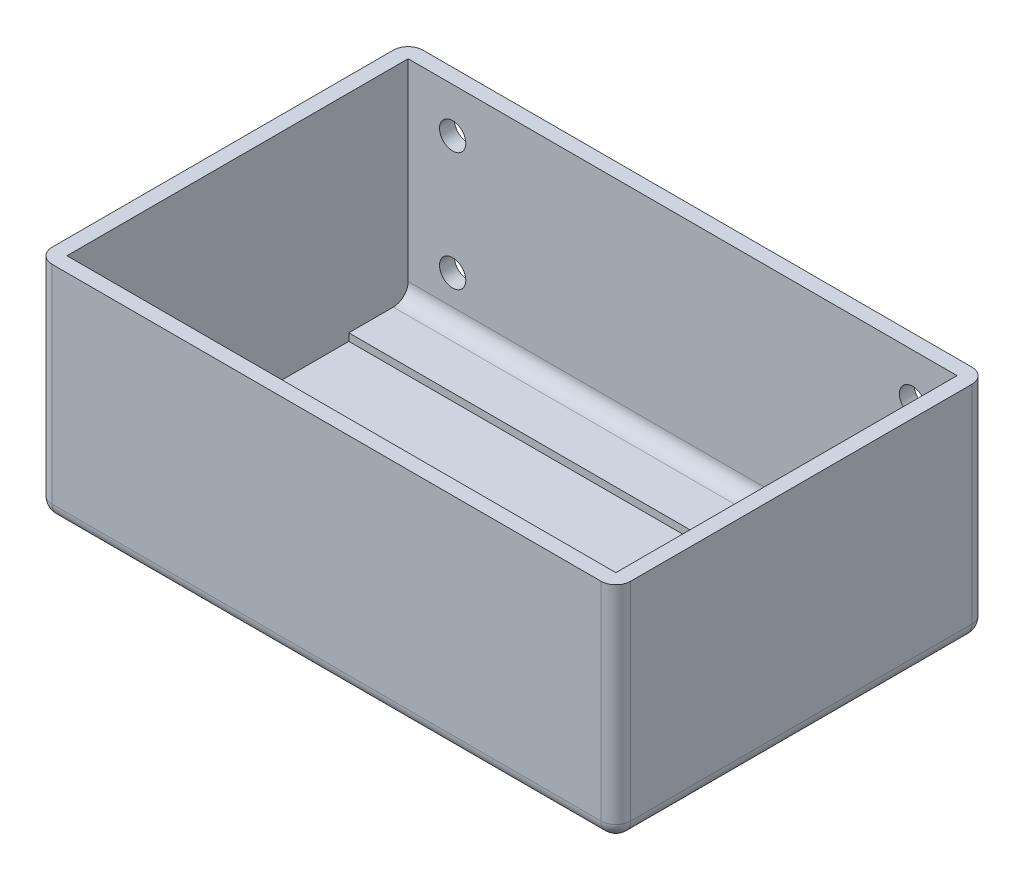
from build123d import *

# Parameters (mm, degrees)
BOSS_EXTRUDE1_DEPTH      = 48.26
FILLET1_R                = 2.5399999999999996
BOSS_EXTRUDE2_START      = -48.26
BOSS_EXTRUDE2_DEPTH      = 2.5399999999999996
BOSS_EXTRUDE3_START      = 48.26
BOSS_EXTRUDE3_DEPTH      = 2.5399999999999996
CUT_EXTRUDE2_START       = -29.21
SKETCH4_R                = 6.349999999999995
CUT_EXTRUDE2_DEPTH       = 2.54
FILLET2_R                = 2.5399999999999996
M4_CLEARANCE_HOLE1_D     = 4.5
M4_CLEARANCE_HOLE1_DEPTH = 2.54


with BuildPart() as part:
    # Sketch1 → Boss-Extrude1 (new, symmetric)
    with BuildSketch(Plane(origin=(0, 0, 0), x_dir=(0, 0, -1), z_dir=(1, 0, 0))):
        Polygon((31.75, -7.8e-16), (-31.75, -8.55e-15), (-31.75, 38.099999999999994), (-29.21, 38.099999999999994), (-29.209999999999997, 2.539999999999991), (-19.049999999999997, 2.539999999999991), (-19.049999999999997, 1.2699999999999922), (-6.350000000000001, 1.2699999999999922), (-6.35, 2.5399999999999943), (6.35, 2.539999999999996), (6.350000000000001, 1.2699999999999938), (19.049999999999997, 1.2699999999999971), (19.049999999999997, 2.539999999999996), (29.209999999999997, 2.539999999999998), (29.209999999999994, 38.1), (31.749999999999986, 38.1), align=None)
    extrude(amount=BOSS_EXTRUDE1_DEPTH, both=True)

    # Fillet1
    fillet1_edges = [part.edges().sort_by_distance(p)[0] for p in [
        (0, -8.55e-15, 31.75),
        (0, -7.8e-16, -31.75),
        (0, 2.539999999999998, -29.209999999999997),
        (0, 2.539999999999991, 29.209999999999997),
    ]]
    fillet(fillet1_edges, radius=FILLET1_R)

    # Sketch3 → Boss-Extrude2 (add)
    with BuildSketch(Plane(origin=(0, 0, 0), x_dir=(0, 0, -1), z_dir=(1, 0, 0)).offset(BOSS_EXTRUDE2_START)):
        with BuildLine():
            Line((0, 38.099999999999994), (-31.75, 38.099999999999994))
            Line((-31.75, 38.099999999999994), (-31.75, 2.539999999999992))
            ThreePointArc((-31.75, 2.5399999999999934), (-31.00605122421383, 0.7439487757861607), (-29.209999999999997, -7.55e-15))
            Line((-29.209999999999997, -7.81e-15), (0, -4.23e-15))
            Line((0, 0), (1.56e-15, 38.099999999999994))
        make_face()
        with BuildLine():
            Line((31.75, 38.1), (0, 38.099999999999994))
            Line((1.56e-15, 38.099999999999994), (0, 0))
            Line((0, -4.23e-15), (29.210000000000004, -6.5e-16))
            ThreePointArc((29.210000000000004, -2.22e-15), (31.00605122421384, 0.7439487757861647), (31.750000000000014, 2.540000000000001))
            Line((31.750000000000014, 2.539999999999999), (31.75, 38.1))
        make_face()
    extrude(amount=BOSS_EXTRUDE2_DEPTH)

    # Sketch3<3> → Boss-Extrude3 (add)
    with BuildSketch(Plane(origin=(0, 0, 0), x_dir=(0, 0, -1), z_dir=(1, 0, 0)).offset(BOSS_EXTRUDE3_START)):
        with BuildLine():
            Line((31.75, 38.1), (0, 38.099999999999994))
            Line((1.56e-15, 38.099999999999994), (0, 0))
            Line((0, -4.23e-15), (29.210000000000004, -6.5e-16))
            ThreePointArc((29.210000000000004, -2.22e-15), (31.00605122421384, 0.7439487757861647), (31.750000000000014, 2.540000000000001))
            Line((31.750000000000014, 2.539999999999999), (31.75, 38.1))
        make_face()
        with BuildLine():
            Line((0, 38.099999999999994), (-31.75, 38.099999999999994))
            Line((-31.75, 38.099999999999994), (-31.75, 2.539999999999992))
            ThreePointArc((-31.75, 2.5399999999999934), (-31.00605122421383, 0.7439487757861607), (-29.209999999999997, -7.55e-15))
            Line((-29.209999999999997, -7.81e-15), (0, -4.23e-15))
            Line((0, 0), (1.56e-15, 38.099999999999994))
        make_face()
    extrude(amount=BOSS_EXTRUDE3_DEPTH)

    # Sketch4 → Cut-Extrude2 (cut)
    with BuildSketch(Plane.XY.offset(CUT_EXTRUDE2_START)):
        with Locations(Location((40.63999999999999, 10.159999999999991, 0), (0, 0, 306.869897646))):
            Circle(SKETCH4_R)
    extrude(amount=-CUT_EXTRUDE2_DEPTH, mode=Mode.SUBTRACT)

    # Fillet2
    fillet2_edges = [part.edges().sort_by_distance(p)[0] for p in [
        (50.8, 20.319999999999993, 31.75),
        (50.8, 0.7439487757861605, 31.00605122421383),
        (50.8, -4.78e-15, -3.55e-15),
        (50.8, 0.7439487757861649, -31.00605122421384),
        (50.8, 20.32, -31.750000000000007),
        (-48.26, 20.32, -31.749999999999993),
        (-48.26, -4.67e-15, 0),
        (-48.26, 20.319999999999993, 31.75),
        (-48.26, 0.7439487757861611, 31.00605122421383),
        (-48.26, 0.7439487757861682, -31.00605122421383),
    ]]
    fillet(fillet2_edges, radius=FILLET2_R)

    # M4 Clearance Hole1
    with Locations(Plane.XY.offset(-29.209999999999997)):
        with Locations((-38.1, 30.48), (40.64, 30.48), (-38.1, 10.16)):
            Hole(M4_CLEARANCE_HOLE1_D / 2, depth=M4_CLEARANCE_HOLE1_DEPTH)


solid = part.part
